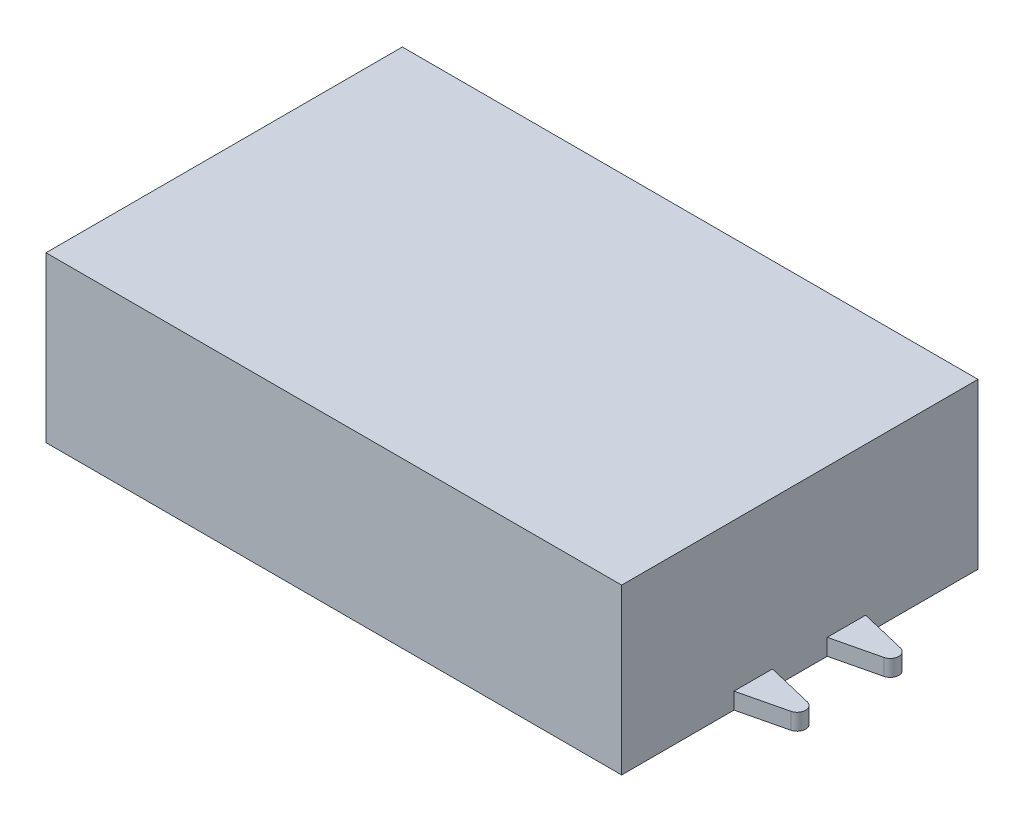
from build123d import *

# Parameters (mm, degrees)
SKETCH1_W            = 105
SKETCH1_H            = 65
BOSS_EXTRUDE1_DEPTH  = 30
BOSS_EXTRUDE2_DEPTH  = 3
MIRROR2_COPY_1_DEPTH = 3


with BuildPart() as part:
    # Sketch1 → Boss-Extrude1 (new body)
    with BuildSketch(Plane(origin=(0, 0, 0), x_dir=(1, 0, 0), z_dir=(0, 1, 0))):
        Rectangle(SKETCH1_W, SKETCH1_H)
    extrude(amount=BOSS_EXTRUDE1_DEPTH)

    # Sketch3 → Boss-Extrude2 (add)
    with BuildSketch(Plane.XZ):
        with BuildLine():
            Line((52.5, 12), (60.858898944, 10))
            ThreePointArc((60.858898944, 10), (62.042338631, 8.5), (60.858898944, 7))
            Line((60.858898944, 7), (52.5, 5))
            Line((52.5, 5), (52.5, 12))
        make_face()
    boss_extrude2 = extrude(amount=-BOSS_EXTRUDE2_DEPTH)

    # Mirror1: Boss-Extrude2 across plane
    add(boss_extrude2.mirror(Plane.XY))

    # Mirror2: Boss-Extrude2 across plane
    add(boss_extrude2.mirror(Plane(origin=(0, 0, 0), x_dir=(0, 0, 1), z_dir=(1, 0, 0))))

    # Mirror2 copy 1 sketch → Mirror2 copy 1 (add)
    with BuildSketch(Plane(origin=(0, 0, 0), x_dir=(-1, 0, 0), z_dir=(0, -1, 0))):
        with BuildLine():
            Line((52.5, 12), (60.858898944, 10))
            ThreePointArc((60.858898944, 10), (62.042338631, 8.5), (60.858898944, 7))
            Line((60.858898944, 7), (52.5, 5))
            Line((52.5, 5), (52.5, 12))
        make_face()
    extrude(amount=-MIRROR2_COPY_1_DEPTH)


solid = part.part
